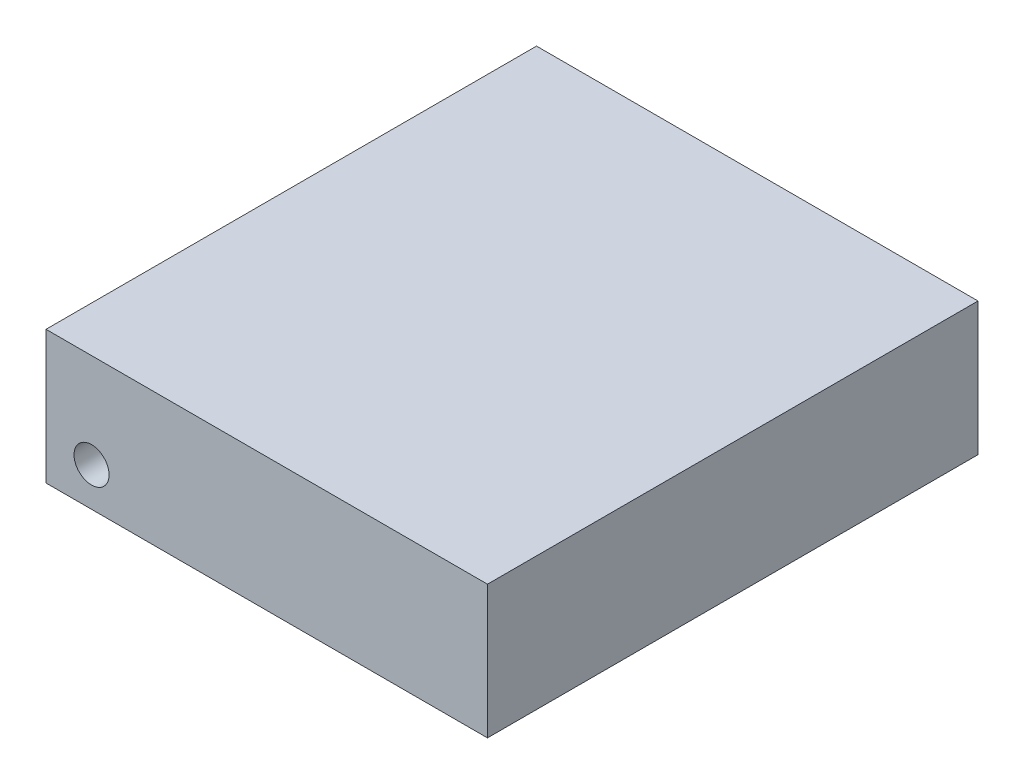
from build123d import *

# Parameters (mm, degrees)
SKETCH1_W           = 63
SKETCH1_H           = 70
BOSS_EXTRUDE1_DEPTH = 19
SKETCH2_R           = 2.5
CUT_EXTRUDE1_DEPTH  = 10


with BuildPart() as part:
    # Sketch1 → Boss-Extrude1 (new body)
    with BuildSketch(Plane(origin=(0, 0, 0), x_dir=(1, 0, 0), z_dir=(0, 1, 0))):
        with Locations((31.5, 35)):
            Rectangle(SKETCH1_W, SKETCH1_H)
    extrude(amount=BOSS_EXTRUDE1_DEPTH)

    # Sketch2 → Cut-Extrude1 (cut)
    with BuildSketch(Plane.XY):
        with Locations((6.5, 5.5)):
            Circle(SKETCH2_R)
    extrude(amount=-CUT_EXTRUDE1_DEPTH, mode=Mode.SUBTRACT)


solid = part.part
